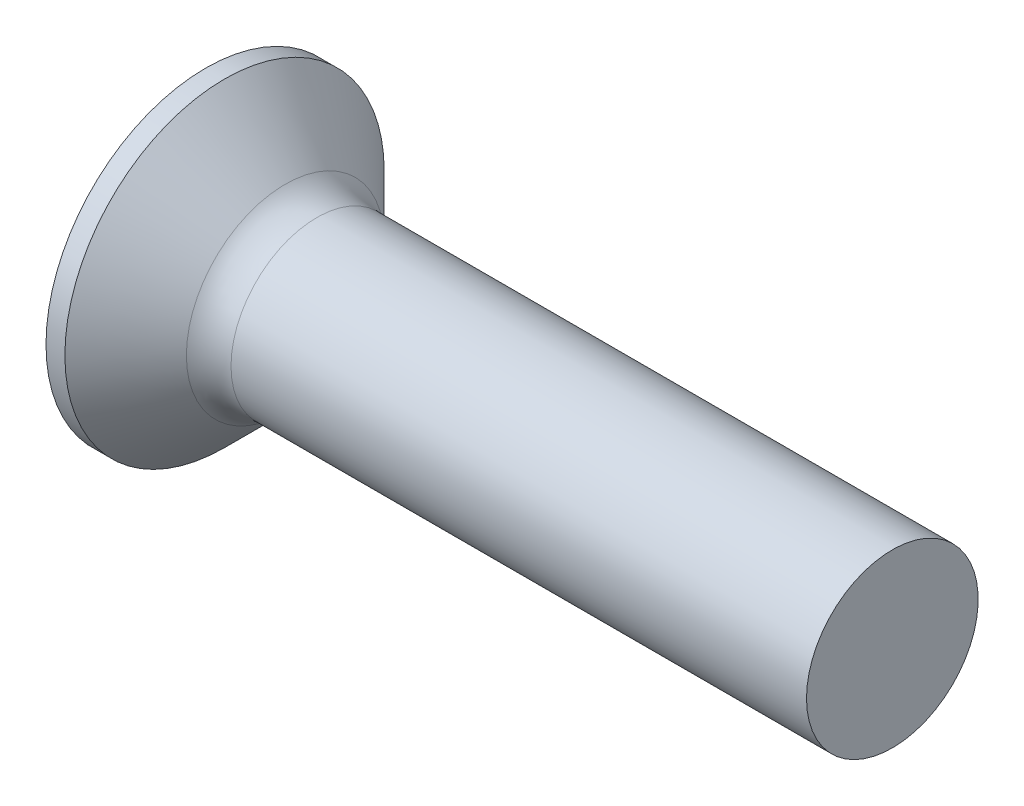
from build123d import *

# Parameters (mm, degrees)
FILLET1_R    = 1.3
RECPAT_COUNT = 2
RECPAT_ANGLE = 90


with BuildPart() as part:
    # BodySke → Base-Revolve (revolve)
    with BuildSketch(Plane.XY, mode=Mode.PRIVATE) as base_revolve_sk:
        Polygon((0, 0), (0, 4.65), (0.55, 4.65), (2.7, 2.5), (20, 2.5), (20, 0), align=None)
    revolve(base_revolve_sk.sketch.rotate(Axis((-6.35, 0, 0), (1, 0, 0)), 90), axis=Axis((-6.35, 0, 0), (1, 0, 0)))

    # Fillet1
    fillet1_edges = [part.edges().sort_by_distance(p)[0] for p in [
        (2.7, 0, -2.5),
    ]]
    fillet(fillet1_edges, radius=FILLET1_R)

    # Sketch3 → Recess section 0
    with BuildSketch(Plane.ZY):
        with BuildLine():
            Line((-0.515, 2.45), (0.515, 2.45))
            Line((0.515, 2.45), (0.515, -2.45))
            Line((0.515, -2.45), (-0.515, -2.45))
            Line((-0.515, -2.45), (-0.515, 2.45))
        make_face()
    # Sketch4 → Recess section 1
    with BuildSketch(Plane.ZY.offset(-3.05)):
        with BuildLine():
            Line((-0.515, 0.929326148), (0.515, 0.929326148))
            Line((0.515, 0.929326148), (0.515, -0.929326148))
            Line((0.515, -0.929326148), (-0.515, -0.929326148))
            Line((-0.515, -0.929326148), (-0.515, 0.929326148))
        make_face()
    recess = loft(mode=Mode.SUBTRACT)

    # RecPat: Recess ×2 about axis
    recpat_axis = Axis((0, 0, 0), (1, 0, 0))
    for i in range(1, RECPAT_COUNT):
        add(recess.rotate(recpat_axis, i * RECPAT_ANGLE / (RECPAT_COUNT - 1)), mode=Mode.SUBTRACT)

    # RecCorSke → RecessCore (revolve, cut)
    with BuildSketch(Plane.XY, mode=Mode.PRIVATE) as recesscore_sk:
        Polygon((0, 0), (0, 1.064276776), (3.05, 0.851), (3.326506661, 0), align=None)
    revolve(recesscore_sk.sketch.rotate(Axis((-3.175, 0, 0), (1, 0, 0)), 90), axis=Axis((-3.175, 0, 0), (1, 0, 0)), mode=Mode.SUBTRACT)


solid = part.part
